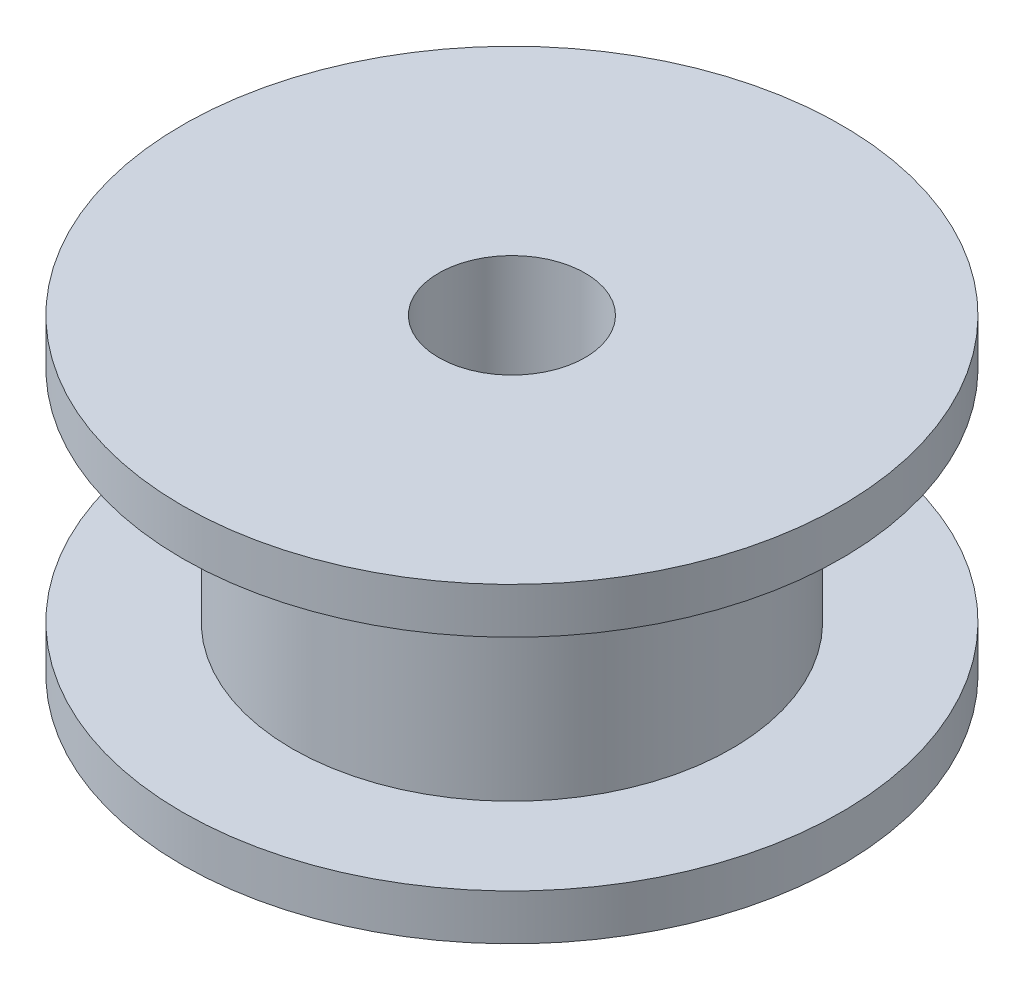
from build123d import *

# Parameters (mm, degrees)
SKETCH1_R           = 9
BOSS_EXTRUDE1_DEPTH = 1.25
SKETCH2_R           = 6
BOSS_EXTRUDE2_DEPTH = 6
SKETCH3_R           = 9
BOSS_EXTRUDE3_DEPTH = 1.25
SKETCH4_R           = 2
CUT_EXTRUDE1_DEPTH  = 10.25


with BuildPart() as part:
    # Sketch1 → Boss-Extrude1 (new body)
    with BuildSketch(Plane(origin=(0, 0, 0), x_dir=(1, 0, 0), z_dir=(0, 1, 0))):
        with Locations(Location((0, 0, 0), (0, 0, 270))):
            Circle(SKETCH1_R)
    extrude(amount=BOSS_EXTRUDE1_DEPTH)

    # Sketch2 → Boss-Extrude2 (add)
    with BuildSketch(Plane(origin=(0, 1.25, 0), x_dir=(1, 0, 0), z_dir=(0, 1, 0))):
        with Locations(Location((0, 0, 0), (0, 0, 270))):
            Circle(SKETCH2_R)
    extrude(amount=BOSS_EXTRUDE2_DEPTH)

    # Sketch3 → Boss-Extrude3 (add)
    with BuildSketch(Plane(origin=(0, 7.25, 0), x_dir=(1, 0, 0), z_dir=(0, 1, 0))):
        with Locations(Location((0, 0, 0), (0, 0, 270))):
            Circle(SKETCH3_R)
    extrude(amount=BOSS_EXTRUDE3_DEPTH)

    # Sketch4 → Cut-Extrude1 (cut)
    with BuildSketch(Plane(origin=(0, 8.5, 0), x_dir=(1, 0, 0), z_dir=(0, 1, 0))):
        with Locations(Location((0, 0, 0), (0, 0, 270))):
            Circle(SKETCH4_R)
    extrude(amount=-CUT_EXTRUDE1_DEPTH, mode=Mode.SUBTRACT)


solid = part.part
